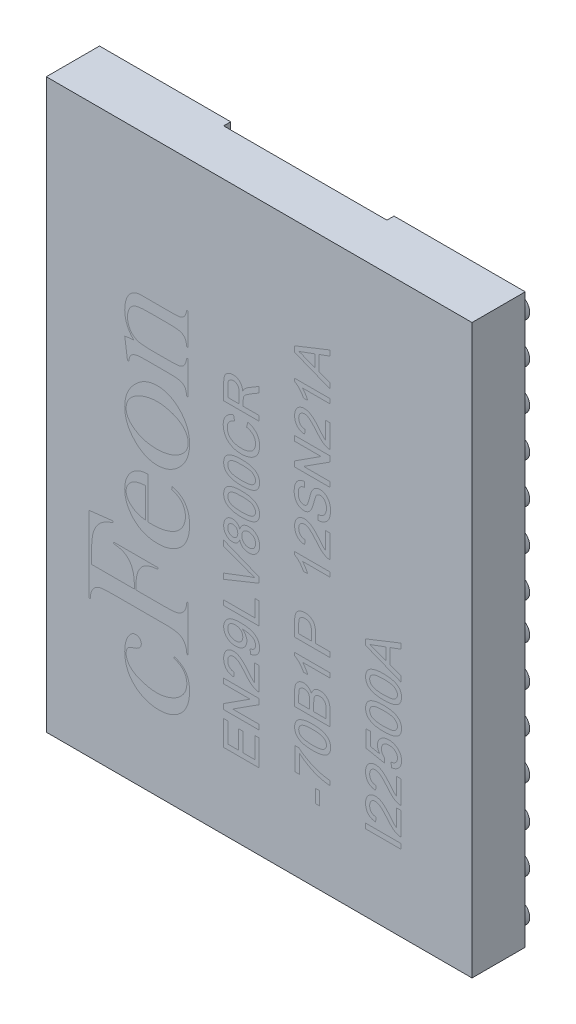
from build123d import *

# Parameters (mm, degrees)
SKETCH_1_W          = 6
SKETCH_1_H          = 8
EXTRUDE_1_DEPTH     = 0.75
SKETCH_2_R          = 0.154
EXTRUDE_2_DEPTH     = 0.1
SKETCH_5_W          = 2.301072574
SKETCH_5_H          = 0.785
CUT_EXTRUDE_3_DEPTH = 0.1
SKETCH_3_W          = 2.301072574
SKETCH_3_H          = 6.43
CUT_EXTRUDE_2_DEPTH = 0.07


with BuildPart() as part:
    # Эскиз1 → Бобышка-Вытянуть1 (new body)
    with BuildSketch(Plane.XY):
        Rectangle(SKETCH_1_W, SKETCH_1_H)
    extrude(amount=EXTRUDE_1_DEPTH)

    # Эскиз2 → Бобышка-Вытянуть2 (add)
    with BuildSketch(Plane(origin=(0, 0, 0), x_dir=(-1, 0, 0), z_dir=(0, 0, -1))):
        with Locations((2.809043524, 3.68)):
            Circle(SKETCH_2_R)
        with Locations((2.809043524, 3.11)):
            Circle(SKETCH_2_R)
        with Locations((2.809043524, 2.54)):
            Circle(SKETCH_2_R)
        with Locations((2.809043524, 1.97)):
            Circle(SKETCH_2_R)
        with Locations((2.809043524, 1.4)):
            Circle(SKETCH_2_R)
        with Locations((2.809043524, 0.83)):
            Circle(SKETCH_2_R)
        with Locations((2.809043524, 0.26)):
            Circle(SKETCH_2_R)
        with Locations((2.359043524, 3.11)):
            Circle(SKETCH_2_R)
        with Locations((2.359043524, 2.54)):
            Circle(SKETCH_2_R)
        with Locations((2.359043524, 1.97)):
            Circle(SKETCH_2_R)
        with Locations((2.359043524, 1.4)):
            Circle(SKETCH_2_R)
        with Locations((2.359043524, 0.83)):
            Circle(SKETCH_2_R)
        with Locations((2.359043524, 0.26)):
            Circle(SKETCH_2_R)
        with Locations((1.909043524, 3.11)):
            Circle(SKETCH_2_R)
        with Locations((1.909043524, 2.54)):
            Circle(SKETCH_2_R)
        with Locations((1.909043524, 1.97)):
            Circle(SKETCH_2_R)
        with Locations((1.909043524, 1.4)):
            Circle(SKETCH_2_R)
        with Locations((1.909043524, 0.83)):
            Circle(SKETCH_2_R)
        with Locations((1.909043524, 0.26)):
            Circle(SKETCH_2_R)
        with Locations((1.459043524, 3.11)):
            Circle(SKETCH_2_R)
        with Locations((1.459043524, 2.54)):
            Circle(SKETCH_2_R)
        with Locations((1.459043524, 1.97)):
            Circle(SKETCH_2_R)
        with Locations((1.459043524, 1.4)):
            Circle(SKETCH_2_R)
        with Locations((1.459043524, 0.83)):
            Circle(SKETCH_2_R)
        with Locations((1.459043524, 0.26)):
            Circle(SKETCH_2_R)
        with Locations((2.359043524, 3.68)):
            Circle(SKETCH_2_R)
        with Locations((1.909043524, 3.68)):
            Circle(SKETCH_2_R)
        with Locations((1.459043524, 3.68)):
            Circle(SKETCH_2_R)
        with Locations(Location((1.459043524, -3.68, 0), (0, 0, 180))):
            Circle(SKETCH_2_R)
        with Locations(Location((1.909043524, -3.68, 0), (0, 0, 180))):
            Circle(SKETCH_2_R)
        with Locations(Location((2.359043524, -3.68, 0), (0, 0, 180))):
            Circle(SKETCH_2_R)
        with Locations(Location((1.459043524, -0.26, 0), (0, 0, 180))):
            Circle(SKETCH_2_R)
        with Locations(Location((1.459043524, -0.83, 0), (0, 0, 180))):
            Circle(SKETCH_2_R)
        with Locations(Location((1.459043524, -1.4, 0), (0, 0, 180))):
            Circle(SKETCH_2_R)
        with Locations(Location((1.459043524, -1.97, 0), (0, 0, 180))):
            Circle(SKETCH_2_R)
        with Locations(Location((1.459043524, -2.54, 0), (0, 0, 180))):
            Circle(SKETCH_2_R)
        with Locations(Location((1.459043524, -3.11, 0), (0, 0, 180))):
            Circle(SKETCH_2_R)
        with Locations(Location((1.909043524, -0.26, 0), (0, 0, 180))):
            Circle(SKETCH_2_R)
        with Locations(Location((1.909043524, -0.83, 0), (0, 0, 180))):
            Circle(SKETCH_2_R)
        with Locations(Location((1.909043524, -1.4, 0), (0, 0, 180))):
            Circle(SKETCH_2_R)
        with Locations(Location((1.909043524, -1.97, 0), (0, 0, 180))):
            Circle(SKETCH_2_R)
        with Locations(Location((1.909043524, -2.54, 0), (0, 0, 180))):
            Circle(SKETCH_2_R)
        with Locations(Location((1.909043524, -3.11, 0), (0, 0, 180))):
            Circle(SKETCH_2_R)
        with Locations(Location((2.359043524, -0.26, 0), (0, 0, 180))):
            Circle(SKETCH_2_R)
        with Locations(Location((2.359043524, -0.83, 0), (0, 0, 180))):
            Circle(SKETCH_2_R)
        with Locations(Location((2.359043524, -1.4, 0), (0, 0, 180))):
            Circle(SKETCH_2_R)
        with Locations(Location((2.359043524, -1.97, 0), (0, 0, 180))):
            Circle(SKETCH_2_R)
        with Locations(Location((2.359043524, -2.54, 0), (0, 0, 180))):
            Circle(SKETCH_2_R)
        with Locations(Location((2.359043524, -3.11, 0), (0, 0, 180))):
            Circle(SKETCH_2_R)
        with Locations(Location((2.809043524, -0.26, 0), (0, 0, 180))):
            Circle(SKETCH_2_R)
        with Locations(Location((2.809043524, -0.83, 0), (0, 0, 180))):
            Circle(SKETCH_2_R)
        with Locations(Location((2.809043524, -1.4, 0), (0, 0, 180))):
            Circle(SKETCH_2_R)
        with Locations(Location((2.809043524, -1.97, 0), (0, 0, 180))):
            Circle(SKETCH_2_R)
        with Locations(Location((2.809043524, -2.54, 0), (0, 0, 180))):
            Circle(SKETCH_2_R)
        with Locations(Location((2.809043524, -3.11, 0), (0, 0, 180))):
            Circle(SKETCH_2_R)
        with Locations((-2.809043524, -3.11)):
            Circle(SKETCH_2_R)
        with Locations((-2.809043524, -2.54)):
            Circle(SKETCH_2_R)
        with Locations((-2.809043524, -1.97)):
            Circle(SKETCH_2_R)
        with Locations((-2.809043524, -1.4)):
            Circle(SKETCH_2_R)
        with Locations((-2.809043524, -0.83)):
            Circle(SKETCH_2_R)
        with Locations((-2.809043524, -0.26)):
            Circle(SKETCH_2_R)
        with Locations((-2.359043524, -3.11)):
            Circle(SKETCH_2_R)
        with Locations((-2.359043524, -2.54)):
            Circle(SKETCH_2_R)
        with Locations((-2.359043524, -1.97)):
            Circle(SKETCH_2_R)
        with Locations((-2.359043524, -1.4)):
            Circle(SKETCH_2_R)
        with Locations((-2.359043524, -0.83)):
            Circle(SKETCH_2_R)
        with Locations((-2.359043524, -0.26)):
            Circle(SKETCH_2_R)
        with Locations((-1.909043524, -3.11)):
            Circle(SKETCH_2_R)
        with Locations((-1.909043524, -2.54)):
            Circle(SKETCH_2_R)
        with Locations((-1.909043524, -1.97)):
            Circle(SKETCH_2_R)
        with Locations((-1.909043524, -1.4)):
            Circle(SKETCH_2_R)
        with Locations((-1.909043524, -0.83)):
            Circle(SKETCH_2_R)
        with Locations((-1.909043524, -0.26)):
            Circle(SKETCH_2_R)
        with Locations((-1.459043524, -3.11)):
            Circle(SKETCH_2_R)
        with Locations((-1.459043524, -2.54)):
            Circle(SKETCH_2_R)
        with Locations((-1.459043524, -1.97)):
            Circle(SKETCH_2_R)
        with Locations((-1.459043524, -1.4)):
            Circle(SKETCH_2_R)
        with Locations((-1.459043524, -0.83)):
            Circle(SKETCH_2_R)
        with Locations((-1.459043524, -0.26)):
            Circle(SKETCH_2_R)
        with Locations((-2.359043524, -3.68)):
            Circle(SKETCH_2_R)
        with Locations((-1.909043524, -3.68)):
            Circle(SKETCH_2_R)
        with Locations((-1.459043524, -3.68)):
            Circle(SKETCH_2_R)
        with Locations(Location((-1.459043524, 3.68, 0), (0, 0, 180))):
            Circle(SKETCH_2_R)
        with Locations(Location((-1.909043524, 3.68, 0), (0, 0, 180))):
            Circle(SKETCH_2_R)
        with Locations(Location((-2.359043524, 3.68, 0), (0, 0, 180))):
            Circle(SKETCH_2_R)
        with Locations(Location((-1.459043524, 0.26, 0), (0, 0, 180))):
            Circle(SKETCH_2_R)
        with Locations(Location((-1.459043524, 0.83, 0), (0, 0, 180))):
            Circle(SKETCH_2_R)
        with Locations(Location((-1.459043524, 1.4, 0), (0, 0, 180))):
            Circle(SKETCH_2_R)
        with Locations(Location((-1.459043524, 1.97, 0), (0, 0, 180))):
            Circle(SKETCH_2_R)
        with Locations(Location((-1.459043524, 2.54, 0), (0, 0, 180))):
            Circle(SKETCH_2_R)
        with Locations(Location((-1.459043524, 3.11, 0), (0, 0, 180))):
            Circle(SKETCH_2_R)
        with Locations(Location((-1.909043524, 0.26, 0), (0, 0, 180))):
            Circle(SKETCH_2_R)
        with Locations(Location((-1.909043524, 0.83, 0), (0, 0, 180))):
            Circle(SKETCH_2_R)
        with Locations(Location((-1.909043524, 1.4, 0), (0, 0, 180))):
            Circle(SKETCH_2_R)
        with Locations(Location((-1.909043524, 1.97, 0), (0, 0, 180))):
            Circle(SKETCH_2_R)
        with Locations(Location((-1.909043524, 2.54, 0), (0, 0, 180))):
            Circle(SKETCH_2_R)
        with Locations(Location((-1.909043524, 3.11, 0), (0, 0, 180))):
            Circle(SKETCH_2_R)
        with Locations(Location((-2.359043524, 0.26, 0), (0, 0, 180))):
            Circle(SKETCH_2_R)
        with Locations(Location((-2.359043524, 0.83, 0), (0, 0, 180))):
            Circle(SKETCH_2_R)
        with Locations(Location((-2.359043524, 1.4, 0), (0, 0, 180))):
            Circle(SKETCH_2_R)
        with Locations(Location((-2.359043524, 1.97, 0), (0, 0, 180))):
            Circle(SKETCH_2_R)
        with Locations(Location((-2.359043524, 2.54, 0), (0, 0, 180))):
            Circle(SKETCH_2_R)
        with Locations(Location((-2.359043524, 3.11, 0), (0, 0, 180))):
            Circle(SKETCH_2_R)
        with Locations(Location((-2.809043524, 0.26, 0), (0, 0, 180))):
            Circle(SKETCH_2_R)
        with Locations(Location((-2.809043524, 0.83, 0), (0, 0, 180))):
            Circle(SKETCH_2_R)
        with Locations(Location((-2.809043524, 1.4, 0), (0, 0, 180))):
            Circle(SKETCH_2_R)
        with Locations(Location((-2.809043524, 1.97, 0), (0, 0, 180))):
            Circle(SKETCH_2_R)
        with Locations(Location((-2.809043524, 2.54, 0), (0, 0, 180))):
            Circle(SKETCH_2_R)
        with Locations(Location((-2.809043524, 3.11, 0), (0, 0, 180))):
            Circle(SKETCH_2_R)
        with Locations(Location((-2.809043524, 3.68, 0), (0, 0, 180))):
            Circle(SKETCH_2_R)
        with Locations((-2.809043524, -3.705)):
            Circle(SKETCH_2_R)
    extrude(amount=EXTRUDE_2_DEPTH)

    # Эскиз5 → Вырез-Вытянуть3 (cut)
    with BuildSketch(Plane(origin=(0, 0, 0), x_dir=(-1, 0, 0), z_dir=(0, 0, -1))):
        with Locations((0, 3.6075)):
            Rectangle(SKETCH_5_W, SKETCH_5_H)
        with Locations((0, -3.6075)):
            Rectangle(SKETCH_5_W, SKETCH_5_H)
    extrude(amount=-CUT_EXTRUDE_3_DEPTH, mode=Mode.SUBTRACT)

    # Эскиз3 → Вырез-Вытянуть2 (cut)
    with BuildSketch(Plane(origin=(0, 0, 0), x_dir=(-1, 0, 0), z_dir=(0, 0, -1))):
        Rectangle(SKETCH_3_W, SKETCH_3_H)
    extrude(amount=-CUT_EXTRUDE_2_DEPTH, mode=Mode.SUBTRACT)


solid = part.part
